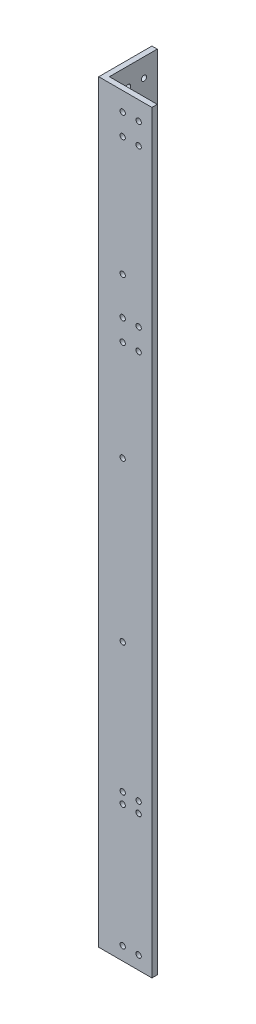
from build123d import *

# Parameters (mm, degrees)
BOSS_EXTRUDE1_DEPTH              = 450
LEFTSIDEHOLES_SKETCH3_R          = 1.5875
LEFTSIDEHOLES_CUT_EXTRUDE1_DEPTH = 3.175
BACKSIDEHOLES_SKETCH4_R          = 1.5875
BACKSIDEHOLES_CUT_EXTRUDE2_DEPTH = 3.175


with BuildPart() as part:
    # Sketch2 → Boss-Extrude1 (new body)
    with BuildSketch(Plane(origin=(0, 0, 0), x_dir=(1, 0, 0), z_dir=(0, 1, 0))):
        Polygon((0, 31.75), (3.175, 31.75), (3.175, 3.175), (31.75, 3.175), (31.75, 0), (0, 0), align=None)
    extrude(amount=BOSS_EXTRUDE1_DEPTH)

    # LeftSideHoles-Sketch3 → LeftSideHoles-Cut-Extrude1 (cut)
    with BuildSketch(Plane.XY):
        with Locations((14.2875, 81.1125)):
            Circle(LEFTSIDEHOLES_SKETCH3_R)
        with Locations((23.8125, 81.1125)):
            Circle(LEFTSIDEHOLES_SKETCH3_R)
        with Locations((14.2875, 87.4625)):
            Circle(LEFTSIDEHOLES_SKETCH3_R)
        with Locations((23.8125, 87.4625)):
            Circle(LEFTSIDEHOLES_SKETCH3_R)
        with Locations((14.2875, 438.8875)):
            Circle(LEFTSIDEHOLES_SKETCH3_R)
        with Locations((14.2875, 426.1875)):
            Circle(LEFTSIDEHOLES_SKETCH3_R)
        with Locations((23.8125, 438.8875)):
            Circle(LEFTSIDEHOLES_SKETCH3_R)
        with Locations((23.8125, 426.1875)):
            Circle(LEFTSIDEHOLES_SKETCH3_R)
        with Locations((14.2875, 332.602644)):
            Circle(LEFTSIDEHOLES_SKETCH3_R)
        with Locations((23.8125, 332.602644)):
            Circle(LEFTSIDEHOLES_SKETCH3_R)
        with Locations((14.2875, 319.902644)):
            Circle(LEFTSIDEHOLES_SKETCH3_R)
        with Locations((23.8125, 319.902644)):
            Circle(LEFTSIDEHOLES_SKETCH3_R)
        with Locations((14.2875, 7.9375)):
            Circle(LEFTSIDEHOLES_SKETCH3_R)
        with Locations((23.8125, 7.9375)):
            Circle(LEFTSIDEHOLES_SKETCH3_R)
        with Locations((14.2875, 165)):
            Circle(LEFTSIDEHOLES_SKETCH3_R)
        with Locations((14.2875, 260)):
            Circle(LEFTSIDEHOLES_SKETCH3_R)
        with Locations((14.2875, 355)):
            Circle(LEFTSIDEHOLES_SKETCH3_R)
    extrude(amount=-LEFTSIDEHOLES_CUT_EXTRUDE1_DEPTH, mode=Mode.SUBTRACT)

    # BackSideHoles-Sketch4 → BackSideHoles-Cut-Extrude2 (cut)
    with BuildSketch(Plane.ZY):
        with Locations((-23.8125, 81.1125)):
            Circle(BACKSIDEHOLES_SKETCH4_R)
        with Locations((-14.2875, 81.1125)):
            Circle(BACKSIDEHOLES_SKETCH4_R)
        with Locations((-23.8125, 87.4625)):
            Circle(BACKSIDEHOLES_SKETCH4_R)
        with Locations((-14.2875, 87.4625)):
            Circle(BACKSIDEHOLES_SKETCH4_R)
        with Locations((-23.8125, 438.8875)):
            Circle(BACKSIDEHOLES_SKETCH4_R)
        with Locations((-14.2875, 438.8875)):
            Circle(BACKSIDEHOLES_SKETCH4_R)
        with Locations((-23.8125, 426.1875)):
            Circle(BACKSIDEHOLES_SKETCH4_R)
        with Locations((-14.2875, 426.1875)):
            Circle(BACKSIDEHOLES_SKETCH4_R)
        with Locations((-23.8125, 332.602644)):
            Circle(BACKSIDEHOLES_SKETCH4_R)
        with Locations((-14.2875, 332.602644)):
            Circle(BACKSIDEHOLES_SKETCH4_R)
        with Locations((-23.8125, 326.252644)):
            Circle(BACKSIDEHOLES_SKETCH4_R)
        with Locations((-14.2875, 326.252644)):
            Circle(BACKSIDEHOLES_SKETCH4_R)
        with Locations((-14.2875, 165)):
            Circle(BACKSIDEHOLES_SKETCH4_R)
        with Locations((-14.2875, 260)):
            Circle(BACKSIDEHOLES_SKETCH4_R)
        with Locations((-14.2875, 355)):
            Circle(BACKSIDEHOLES_SKETCH4_R)
    extrude(amount=-BACKSIDEHOLES_CUT_EXTRUDE2_DEPTH, mode=Mode.SUBTRACT)


solid = part.part
